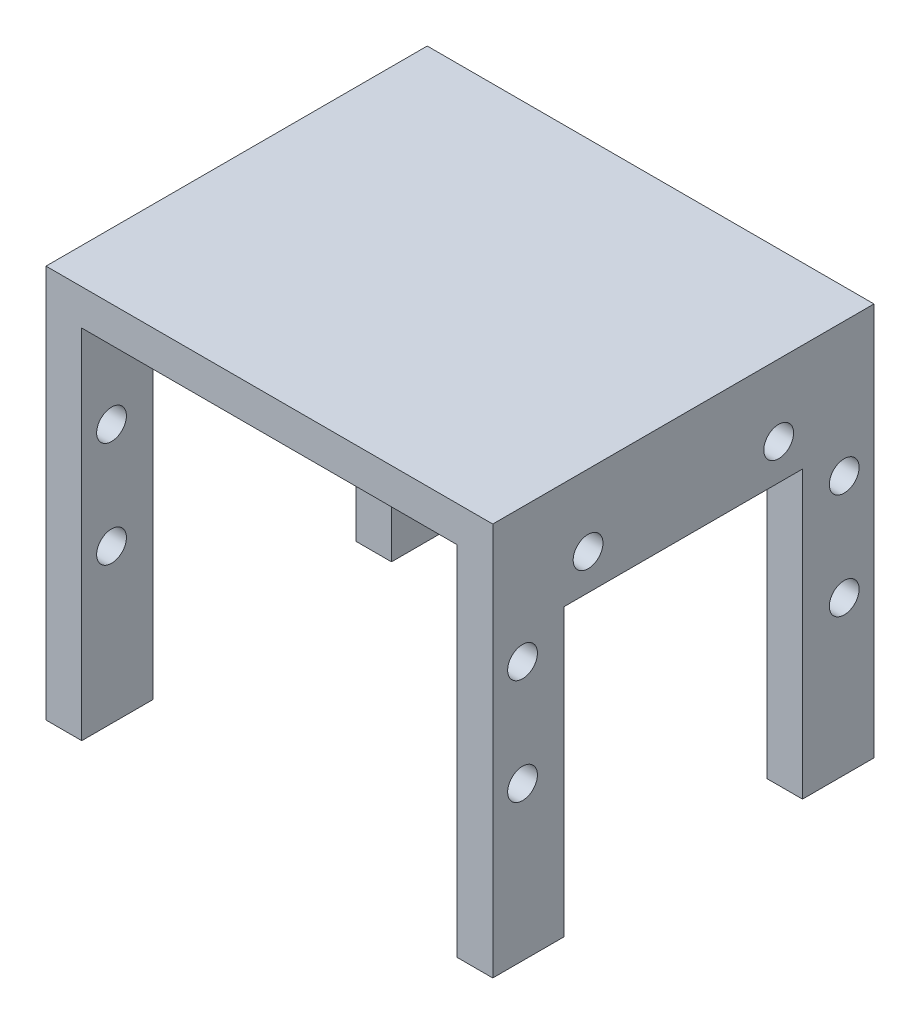
from build123d import *

# Parameters (mm, degrees)
BOSS_EXTRUDE1_DEPTH = 32
CUT_EXTRUDE2_REACH  = 61.323
SKETCH3_W           = 20
SKETCH3_H           = 24
CUT_EXTRUDE3_START  = -37.5
SKETCH4_R           = 1.25
CUT_EXTRUDE3_DEPTH  = 37.5


with BuildPart() as part:
    # Sketch1 → Boss-Extrude1 (new body)
    with BuildSketch(Plane.XY):
        Polygon((0, 0), (0, 30), (31.5, 30), (31.5, 0), (34.5, 0), (34.5, 33), (-3, 33), (-3, 0), align=None)
    extrude(amount=BOSS_EXTRUDE1_DEPTH)

    # Cut-Extrude2: up to this face of the body (flat: up to its plane)
    cut_extrude2_end = Plane(part.part.faces().sort_by_distance((-3, 16.5, 16))[0])
    # Sketch3 → Cut-Extrude2 (cut, up to the picked face)
    with BuildSketch(Plane(origin=(34.5, 0, 0), x_dir=(0, 0, -1), z_dir=(1, 0, 0)), mode=Mode.PRIVATE) as cut_extrude2_sk1:
        with Locations((-16, 12)):
            Rectangle(SKETCH3_W, SKETCH3_H)
    cut_extrude2_tool1 = split(extrude(cut_extrude2_sk1.sketch, amount=-CUT_EXTRUDE2_REACH, mode=Mode.PRIVATE), bisect_by=cut_extrude2_end, keep=Keep.BOTH, mode=Mode.PRIVATE)
    add(cut_extrude2_tool1.solids().sort_by(Axis((34.5, 12, 16), (-1, 0, 0)))[0], mode=Mode.SUBTRACT)

    # Sketch4 → Cut-Extrude3 (cut)
    with BuildSketch(Plane(origin=(34.5, 0, 0), x_dir=(0, 0, -1), z_dir=(1, 0, 0)).offset(CUT_EXTRUDE3_START)):
        with Locations((-24, 27)):
            Circle(SKETCH4_R)
        with Locations((-8, 27)):
            Circle(SKETCH4_R)
        with Locations((-2.5, 21.75)):
            Circle(SKETCH4_R)
        with Locations((-2.5, 12.89624)):
            Circle(SKETCH4_R)
        with Locations((-29.5, 21.75)):
            Circle(SKETCH4_R)
        with Locations((-29.5, 12.89624)):
            Circle(SKETCH4_R)
    extrude(amount=CUT_EXTRUDE3_DEPTH, mode=Mode.SUBTRACT)


solid = part.part
